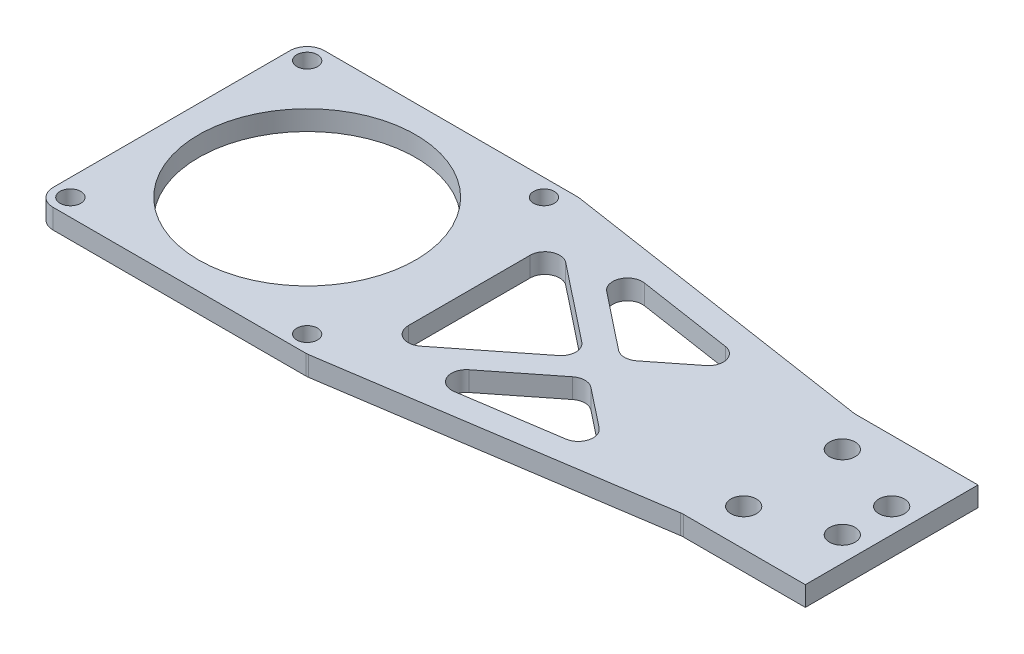
from build123d import *

# Parameters (mm, degrees)
SKETCH_1_W               = 25
SKETCH_1_H               = 35
SKETCH_1_R               = 2.6
EXTRUDE_1_DEPTH          = 4
EXTRUDE_2_DEPTH          = 4
FILLET_1_R               = 3.5
CUT_EXTRUDE_1_DEPTH      = 10
SKETCH_4_R               = 2.1
CUT_EXTRUDE_2_DEPTH      = 10
PATTERN_CIRCULAR_1_COUNT = 4
CUT_EXTRUDE_3_DEPTH      = 163


with BuildPart() as part:
    # 草图1 → 凸台-拉伸1 (new body)
    with BuildSketch(Plane(origin=(0, 0, 0), x_dir=(1, 0, 0), z_dir=(0, 1, 0))):
        Rectangle(SKETCH_1_W, SKETCH_1_H)
        with Locations(Location((7.5, 5, 0), (0, 0, 270))):
            Circle(SKETCH_1_R, mode=Mode.SUBTRACT)
        with Locations(Location((7.5, -5, 0), (0, 0, 270))):
            Circle(SKETCH_1_R, mode=Mode.SUBTRACT)
        with Locations(Location((-7.5, -10, 0), (0, 0, 270))):
            Circle(SKETCH_1_R, mode=Mode.SUBTRACT)
        with Locations(Location((-7.5, 10, 0), (0, 0, 270))):
            Circle(SKETCH_1_R, mode=Mode.SUBTRACT)
    extrude(amount=EXTRUDE_1_DEPTH)


with BuildPart() as body_2:
    # 草图2 → 凸台-拉伸2 (new body)
    with BuildSketch(Plane(origin=(0, 4, 0), x_dir=(1, 0, 0), z_dir=(0, 1, 0))):
        Polygon((-133.482, 27.5), (-78.482, 27.5), (-12.5, 17.5), (-12.5, -17.5), (-78.482, -27.5), (-133.482, -27.5), align=None)
    extrude(amount=-EXTRUDE_2_DEPTH)


with BuildPart() as part_1:
    add(part.part)

    # Combine 1: union body 2
    add(body_2.part)

    # 圆角1
    fillet_1_edges = [part_1.edges().sort_by_distance(p)[0] for p in [
        (-12.5, 2, -17.5),
        (-12.5, 2, 17.5),
        (-78.482, 2, 27.5),
        (-133.482, 2, 27.5),
        (-133.482, 2, -27.5),
        (-78.482, 2, -27.5),
    ]]
    fillet(fillet_1_edges, radius=FILLET_1_R)

    # 草图3 → 切除-拉伸1 (cut)
    with BuildSketch(Plane(origin=(0, 4, 0), x_dir=(1, 0, 0), z_dir=(0, 1, 0))):
        with BuildLine():
            ThreePointArc((-83.982, 0), (-97.562964488, 20.325349715), (-121.538349186, 15.556349186))
            Line((-121.538349186, 15.556349186), (-105.982, 0))
            Line((-105.982, 0), (-121.538349186, -15.556349186))
            ThreePointArc((-121.538349186, -15.556349186), (-97.562964488, -20.325349715), (-83.982, 0))
        make_face()
        with BuildLine():
            Line((-105.982, 0), (-121.538349186, 15.556349186))
            ThreePointArc((-121.538349186, 15.556349186), (-127.982, 0), (-121.538349186, -15.556349186))
            Line((-121.538349186, -15.556349186), (-105.982, 0))
        make_face()
    extrude(amount=-CUT_EXTRUDE_1_DEPTH, mode=Mode.SUBTRACT)

    # 草图4 → 切除-拉伸2 (cut)
    with BuildSketch(Plane(origin=(0, 4, 0), x_dir=(1, 0, 0), z_dir=(0, 1, 0))):
        with Locations(Location((-81.982, 24, 0), (0, 0, 270))):
            Circle(SKETCH_4_R)
    cut_extrude_2 = extrude(amount=-CUT_EXTRUDE_2_DEPTH, mode=Mode.SUBTRACT)

    # 阵列(圆周)1: 切除-拉伸2 ×4 about axis
    pattern_circular_1_axis = Axis((-105.982, 0, 0), (0, 1, 0))
    for i in range(1, PATTERN_CIRCULAR_1_COUNT):
        add(cut_extrude_2.rotate(pattern_circular_1_axis, i * 360 / PATTERN_CIRCULAR_1_COUNT), mode=Mode.SUBTRACT)

    # 草图5 → 切除-拉伸3 (cut)
    with BuildSketch(Plane(origin=(0, 82, 0), x_dir=(1, 0, 0), z_dir=(0, 1, 0))):
        with BuildLine():
            Line((-43.858652951, 4.717262465), (-36.024929121, 10.900937766))
            ThreePointArc((-36.024929121, 10.900937766), (-34.983693556, 14.023777786), (-37.434169796, 16.221837724))
            Line((-37.434169796, 16.221837724), (-56.789222754, 19.155221519))
            ThreePointArc((-56.789222754, 19.155221519), (-59.99021825, 17.384697858), (-59.100366311, 13.836558948))
            Line((-59.100366311, 13.836558948), (-47.579037182, 4.719499851))
            ThreePointArc((-47.579037182, 4.719499851), (-45.71923377, 4.072034614), (-43.858652951, 4.717262465))
        make_face()
        with BuildLine():
            Line((-35.914624614, -10.886886831), (-43.864253928, -4.59618552))
            ThreePointArc((-43.864253928, -4.59618552), (-45.72405734, -3.948720283), (-47.584638159, -4.593948133))
            Line((-47.584638159, -4.593948133), (-59.336609443, -13.870554782))
            ThreePointArc((-59.336609443, -13.870554782), (-60.230010812, -17.419276174), (-57.028296794, -19.191454741))
            Line((-57.028296794, -19.191454741), (-37.326696195, -16.205549403))
            ThreePointArc((-37.326696195, -16.205549403), (-34.876682386, -14.009233352), (-35.914624614, -10.886886831))
        make_face()
        with BuildLine():
            Line((-68.362482774, -14.625227843), (-52.732917259, -2.287780119))
            ThreePointArc((-52.732917259, -2.287780119), (-51.591694463, 0.065187331), (-52.730086351, 2.419525709))
            Line((-52.730086351, 2.419525709), (-68.359651866, 14.787514754))
            ThreePointArc((-68.359651866, 14.787514754), (-71.528006789, 15.135427044), (-73.221259435, 12.434980533))
            Line((-73.221259435, 12.434980533), (-73.221259435, -12.270456236))
            ThreePointArc((-73.221259435, -12.270456236), (-71.529630563, -14.970116398), (-68.362482774, -14.625227843))
        make_face()
    extrude(amount=-CUT_EXTRUDE_3_DEPTH, mode=Mode.SUBTRACT)


solid = part_1.part
